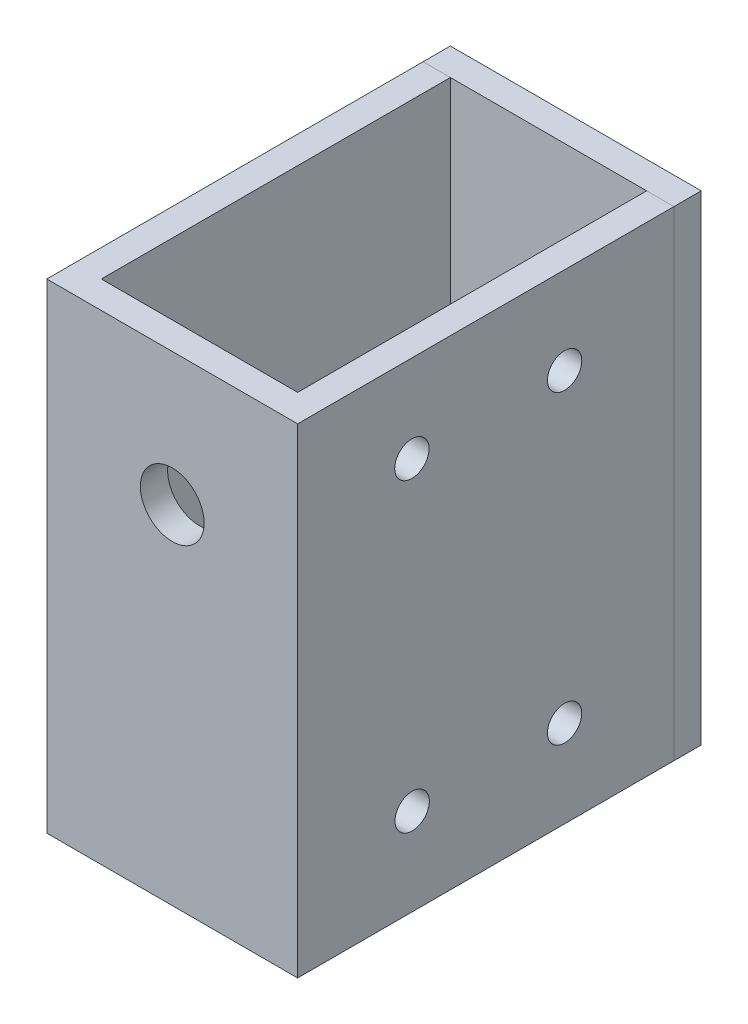
from build123d import *

# Parameters (mm, degrees)
BOSS_EXTRUDE1_DEPTH = 40.64
SKETCH2_W           = 29.21
SKETCH2_H           = 55.88
BOSS_EXTRUDE2_DEPTH = 3.175
SKETCH3_W           = 29.21
SKETCH3_H           = 55.88
SKETCH3_R           = 3.712440594
BOSS_EXTRUDE3_DEPTH = 3.175
SKETCH4_R           = 2
CUT_EXTRUDE1_DEPTH  = 3.175


with BuildPart() as part:
    # Sketch1 → Boss-Extrude1 (new body)
    with BuildSketch(Plane.XY):
        Polygon((0, 0), (0, 55.88), (3.175, 55.88), (3.175, 3.175), (26.035, 3.175), (26.035, 55.88), (29.21, 55.88), (29.21, 0), align=None)
    extrude(amount=BOSS_EXTRUDE1_DEPTH)

    # Sketch3 → Boss-Extrude3 (add)
    with BuildSketch(Plane.XY.offset(40.64)):
        with Locations((14.605, 27.94)):
            Rectangle(SKETCH3_W, SKETCH3_H)
        with Locations((14.605, 40.426288934)):
            Circle(SKETCH3_R, mode=Mode.SUBTRACT)
    extrude(amount=BOSS_EXTRUDE3_DEPTH)

    # Sketch4 → Cut-Extrude1 (cut)
    with BuildSketch(Plane(origin=(29.21, 0, 0), x_dir=(0, 0, -1), z_dir=(1, 0, 0))):
        with Locations((-12.732703056, 45.72)):
            Circle(SKETCH4_R)
        with Locations((-30.48, 10.16)):
            Circle(SKETCH4_R)
        with Locations((-12.732703056, 10.16)):
            Circle(SKETCH4_R)
        with Locations((-30.512703056, 45.72)):
            Circle(SKETCH4_R)
    extrude(amount=-CUT_EXTRUDE1_DEPTH, mode=Mode.SUBTRACT)


with BuildPart() as body_2:
    # Sketch2 → Boss-Extrude2 (new body)
    with BuildSketch(Plane(origin=(0, 0, 0), x_dir=(-1, 0, 0), z_dir=(0, 0, -1))):
        with Locations((-14.605, 27.94)):
            Rectangle(SKETCH2_W, SKETCH2_H)
    extrude(amount=BOSS_EXTRUDE2_DEPTH)


solid = Compound([part.part, body_2.part])
